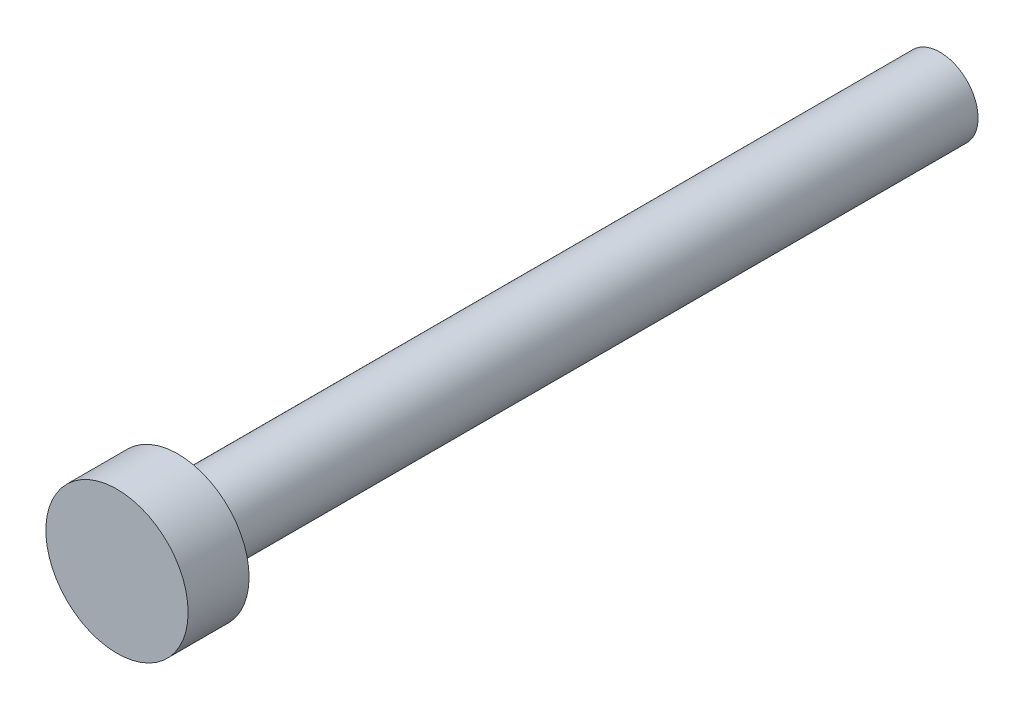
from build123d import *

# Parameters (mm, degrees)
ESQUISSE1_R        = 2.8
BOSS_EXTRU_1_DEPTH = 2.4
ESQUISSE2_R        = 1.5
BOSS_EXTRU_2_DEPTH = 30


with BuildPart() as part:
    # Esquisse1 → Boss.-Extru.1 (new body)
    with BuildSketch(Plane.XY):
        Circle(ESQUISSE1_R)
    extrude(amount=BOSS_EXTRU_1_DEPTH)

    # Esquisse2 → Boss.-Extru.2 (add)
    with BuildSketch(Plane(origin=(0, 0, 0), x_dir=(-1, 0, 0), z_dir=(0, 0, -1))):
        Circle(ESQUISSE2_R)
    extrude(amount=BOSS_EXTRU_2_DEPTH)


solid = part.part
